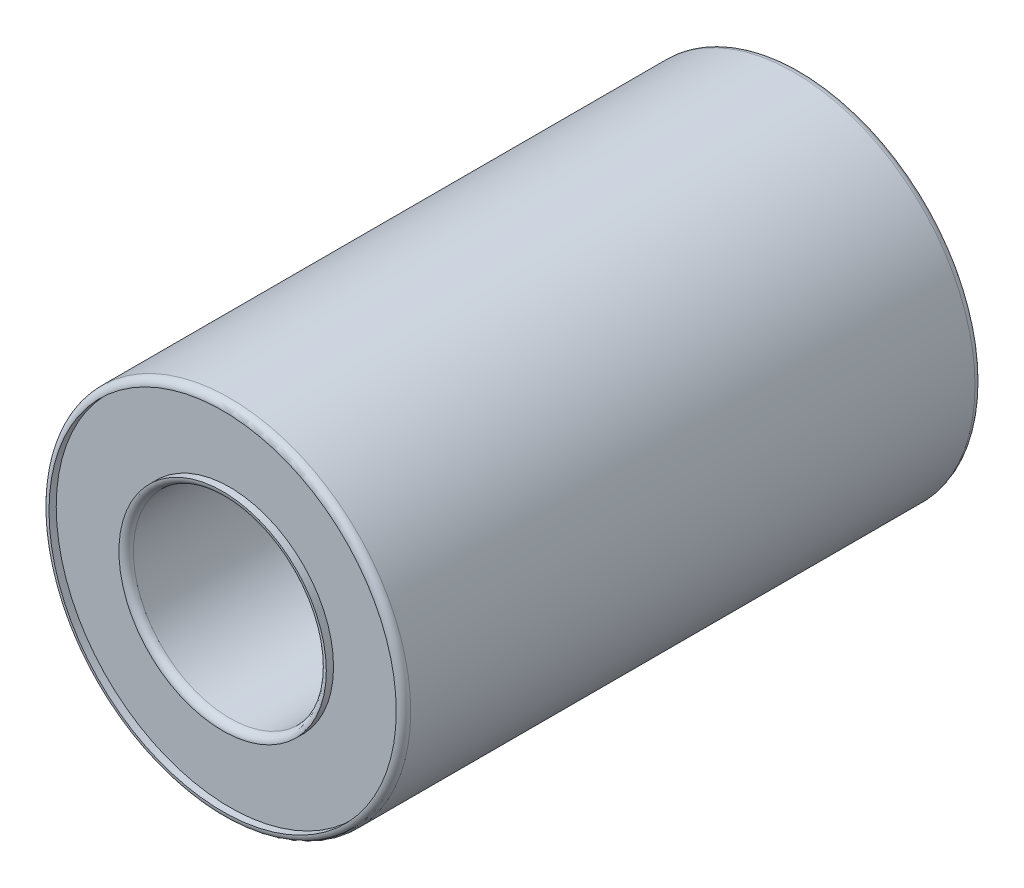
from build123d import *

# Parameters (mm, degrees)
SKETCH1_R           = 7.5
BOSS_EXTRUDE1_DEPTH = 24
SKETCH2_R           = 4
CUT_EXTRUDE1_DEPTH  = 24
FILLET2_R           = 0.3
FILLET3_R           = 0.3
SKETCH3_R           = 7.2
SKETCH3_R_2         = 4.3
CUT_EXTRUDE2_DEPTH  = 0.3
CUT_EXTRUDE4_START  = -0.3
SKETCH4_R           = 7.2
SKETCH4_R_2         = 4.3
CUT_EXTRUDE4_DEPTH  = 0.3


with BuildPart() as part:
    # Sketch1 → Boss-Extrude1 (new body)
    with BuildSketch(Plane.XY):
        Circle(SKETCH1_R)
    extrude(amount=BOSS_EXTRUDE1_DEPTH)

    # Sketch2 → Cut-Extrude1 (cut)
    with BuildSketch(Plane.XY.offset(24)):
        Circle(SKETCH2_R)
    extrude(amount=-CUT_EXTRUDE1_DEPTH, mode=Mode.SUBTRACT)

    # Fillet2
    fillet2_edges = [part.edges().sort_by_distance(p)[0] for p in [
        (-4, 0, 0),
        (-4, 0, 24),
    ]]
    fillet(fillet2_edges, radius=FILLET2_R)

    # Fillet3
    fillet3_edges = [part.edges().sort_by_distance(p)[0] for p in [
        (-7.5, 0, 0),
        (-7.5, 0, 24),
    ]]
    fillet(fillet3_edges, radius=FILLET3_R)

    # Sketch3 → Cut-Extrude2 (cut)
    with BuildSketch(Plane(origin=(0, 0, 0), x_dir=(-1, 0, 0), z_dir=(0, 0, -1))):
        Circle(SKETCH3_R)
        Circle(SKETCH3_R_2, mode=Mode.SUBTRACT)
    extrude(amount=-CUT_EXTRUDE2_DEPTH, mode=Mode.SUBTRACT)

    # Sketch4 → Cut-Extrude4 (cut)
    with BuildSketch(Plane.XY.offset(24).offset(CUT_EXTRUDE4_START)):
        with Locations(Location((0, 0, 0), (0, 0, 180))):
            Circle(SKETCH4_R)
        with Locations(Location((0, 0, 0), (0, 0, 180))):
            Circle(SKETCH4_R_2, mode=Mode.SUBTRACT)
    extrude(amount=CUT_EXTRUDE4_DEPTH, mode=Mode.SUBTRACT)


solid = part.part
